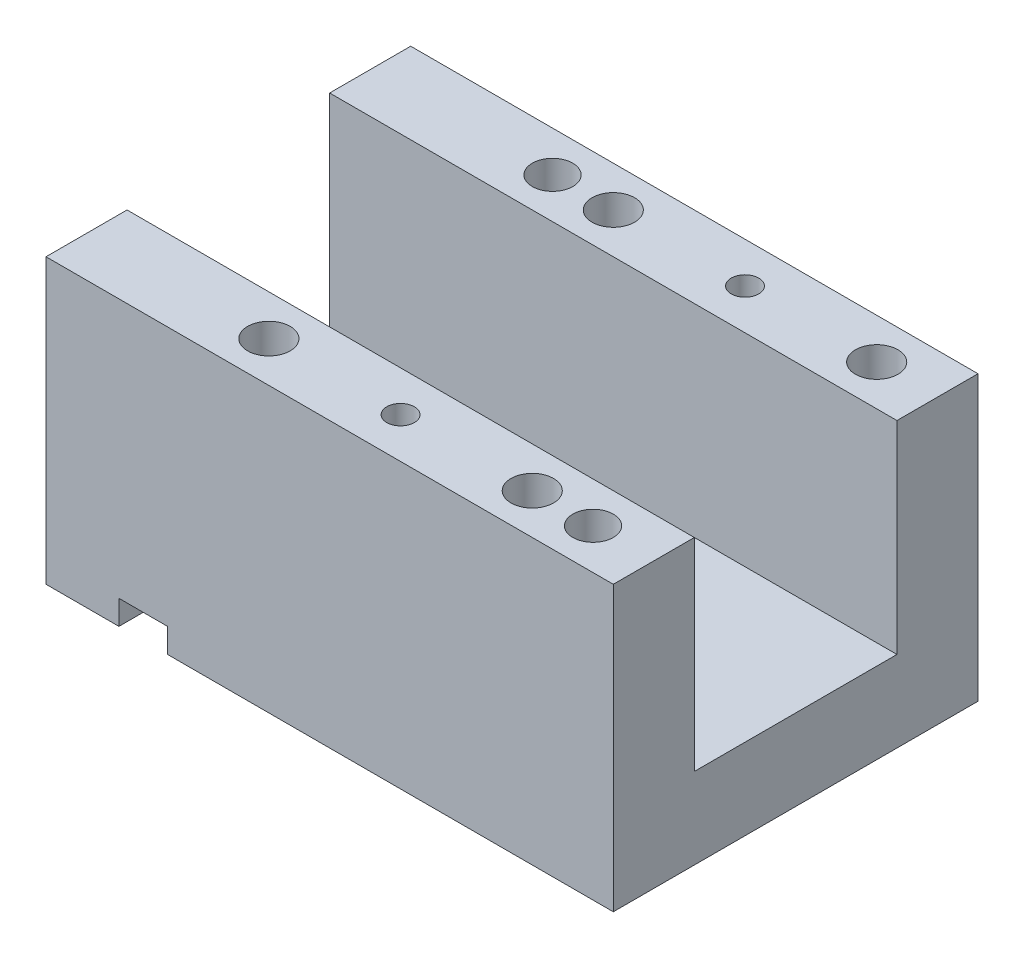
from build123d import *

# Parameters (mm, degrees)
SKETCH1_W               = 140
SKETCH1_H               = 70
BOSS_EXTRUDE1_DEPTH     = 45
CUT_EXTRUDE1_DEPTH      = 109.742815855
CUT_EXTRUDE1_DEPTH_BACK = 50
SKETCH2_W               = 140
SKETCH2_H               = 50
M10_CLEARANCE_HOLE1_D   = 10.5
CUT_EXTRUDE2_DEPTH      = 91.277350426
CUT_EXTRUDE2_DEPTH_BACK = 91.277350426
SKETCH9_W               = 12
SKETCH9_H               = 6
F_10_0MM_DOWEL_HOLE1_D  = 10
M8_TAPPED_HOLE1_D       = 6.8
M8_TAPPED_HOLE1_DEPTH   = 17.707073895
M8_TAPPED_HOLE1_TIP     = 2.042926105
M8_TAPPED_HOLE2_D       = 6.8
M8_TAPPED_HOLE2_DEPTH   = 17.707073895
M8_TAPPED_HOLE2_TIP     = 2.042926105


with BuildPart() as part:
    # Sketch1 → Boss-Extrude1 (new, symmetric)
    with BuildSketch(Plane.XY):
        Rectangle(SKETCH1_W, SKETCH1_H)
    extrude(amount=BOSS_EXTRUDE1_DEPTH, both=True)

    # Sketch2 → Cut-Extrude1 (cut, two sides: drawn at the far end of the back side and taken through both)
    with BuildSketch(Plane(origin=(0, 35, 0), x_dir=(1, 0, 0), z_dir=(0, 1, 0)).offset(-CUT_EXTRUDE1_DEPTH_BACK)):
        Rectangle(SKETCH2_W, SKETCH2_H)
    extrude(amount=CUT_EXTRUDE1_DEPTH + CUT_EXTRUDE1_DEPTH_BACK, mode=Mode.SUBTRACT)

    # M10 Clearance Hole1 (through all)
    with Locations(Plane(origin=(0, 35, 0), x_dir=(1, 0, 0), z_dir=(0, 1, 0))):
        with Locations((55, 35), (40, -35), (-25, -35), (-10, 35)):
            Hole(M10_CLEARANCE_HOLE1_D / 2)

    # Sketch9 → Cut-Extrude2 (cut, two sides: drawn at the far end of the back side and taken through both)
    with BuildSketch(Plane.XY.offset(-CUT_EXTRUDE2_DEPTH_BACK)):
        with Locations((-46, -32)):
            Rectangle(SKETCH9_W, SKETCH9_H)
    extrude(amount=CUT_EXTRUDE2_DEPTH + CUT_EXTRUDE2_DEPTH_BACK, mode=Mode.SUBTRACT)

    # Ø10.0mm Dowel Hole1 (through all)
    with Locations(Plane(origin=(0, 35, 0), x_dir=(1, 0, 0), z_dir=(0, 1, 0))):
        with Locations((55, -35), (-25, 35)):
            Hole(F_10_0MM_DOWEL_HOLE1_D / 2)

    # M8 Tapped Hole1
    with Locations(Plane(origin=(0, 35, 0), x_dir=(1, 0, 0), z_dir=(0, 1, 0))):
        with Locations((22.5, 35), (7.5, -35)):
            Hole(M8_TAPPED_HOLE1_D / 2, depth=M8_TAPPED_HOLE1_DEPTH)
            with Locations((0, 0, -(M8_TAPPED_HOLE1_DEPTH + M8_TAPPED_HOLE1_TIP / 2))):  # 118° drill point
                Cone(0, M8_TAPPED_HOLE1_D / 2, M8_TAPPED_HOLE1_TIP, mode=Mode.SUBTRACT)

    # M8 Tapped Hole2
    with Locations(Plane.ZY.offset(70)):
        with Locations((-35, 23), (-35, -23), (35, 23), (35, -23)):
            Hole(M8_TAPPED_HOLE2_D / 2, depth=M8_TAPPED_HOLE2_DEPTH)
            with Locations((0, 0, -(M8_TAPPED_HOLE2_DEPTH + M8_TAPPED_HOLE2_TIP / 2))):  # 118° drill point
                Cone(0, M8_TAPPED_HOLE2_D / 2, M8_TAPPED_HOLE2_TIP, mode=Mode.SUBTRACT)


solid = part.part
